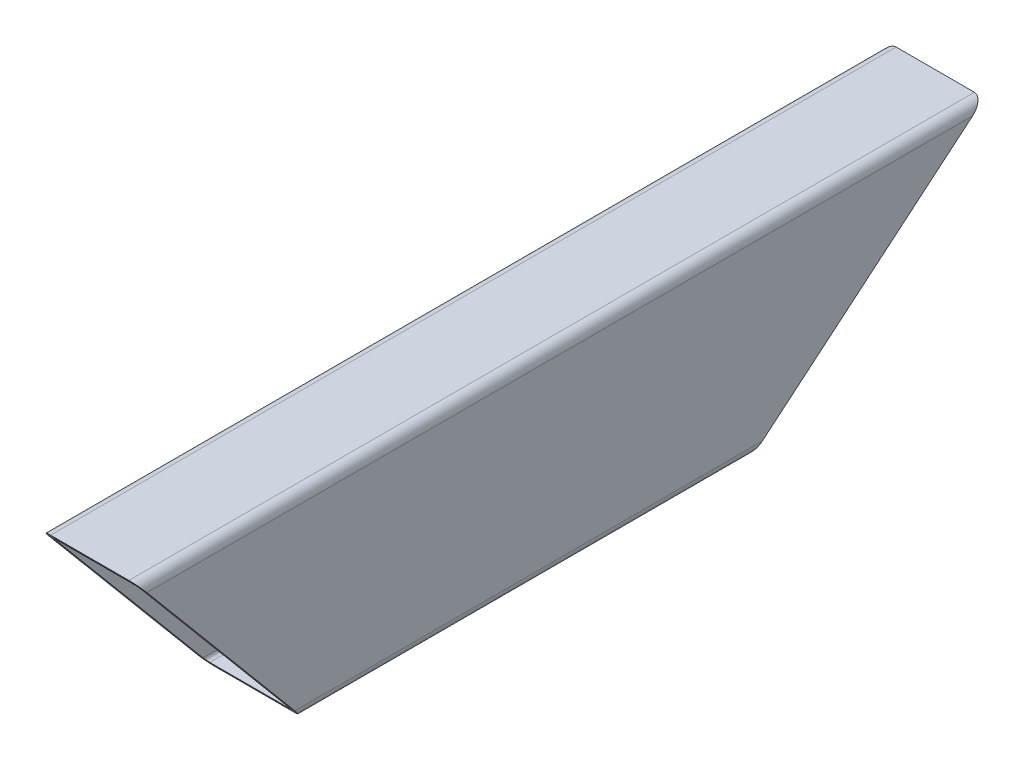
from build123d import *

# Parameters (mm, degrees)
EXTRUDE_THIN1_DEPTH = 219.218052
CUT_EXTRUDE1_DEPTH  = 223.141563699


with BuildPart() as part:
    # Sketch1 → Extrude-Thin1 (new body)
    with BuildSketch(Plane.XY):
        with BuildLine():
            Line((-12.7, 22.86), (-12.7, -22.86))
            ThreePointArc((-12.7, -22.86), (-11.956051224, -24.656051224), (-10.16, -25.4))
            Line((-10.16, -25.4), (10.16, -25.4))
            ThreePointArc((10.16, -25.4), (11.956051224, -24.656051224), (12.7, -22.86))
            Line((12.7, -22.86), (12.7, 22.86))
            ThreePointArc((12.7, 22.86), (11.956051224, 24.656051224), (10.16, 25.4))
            Line((10.16, 25.4), (-10.16, 25.4))
            ThreePointArc((-10.16, 25.4), (-11.956051224, 24.656051224), (-12.7, 22.86))
        make_face()
        with BuildLine():
            Line((-11.1125, 22.86), (-11.1125, -22.86))
            ThreePointArc((-11.1125, -22.86), (-10.833519209, -23.533519209), (-10.16, -23.8125))
            Line((-10.16, -23.8125), (10.16, -23.8125))
            ThreePointArc((10.16, -23.8125), (10.833519209, -23.533519209), (11.1125, -22.86))
            Line((11.1125, -22.86), (11.1125, 22.86))
            ThreePointArc((11.1125, 22.86), (10.833519209, 23.533519209), (10.16, 23.8125))
            Line((10.16, 23.8125), (-10.16, 23.8125))
            ThreePointArc((-10.16, 23.8125), (-10.833519209, 23.533519209), (-11.1125, 22.86))
        make_face(mode=Mode.SUBTRACT)
    extrude(amount=EXTRUDE_THIN1_DEPTH)

    # Sketch2 → Cut-Extrude1 (cut, through all)
    with BuildSketch(Plane(origin=(12.7, 0, 0), x_dir=(0, 0, -1), z_dir=(1, 0, 0))):
        Polygon((-219.218051789, 25.4), (-176.591790525, -25.4), (-219.218051789, -25.4), align=None)
        Polygon((0, 25.4), (-60.541082504, -25.4), (0, -25.4), align=None)
    extrude(amount=-CUT_EXTRUDE1_DEPTH, mode=Mode.SUBTRACT)


solid = part.part
